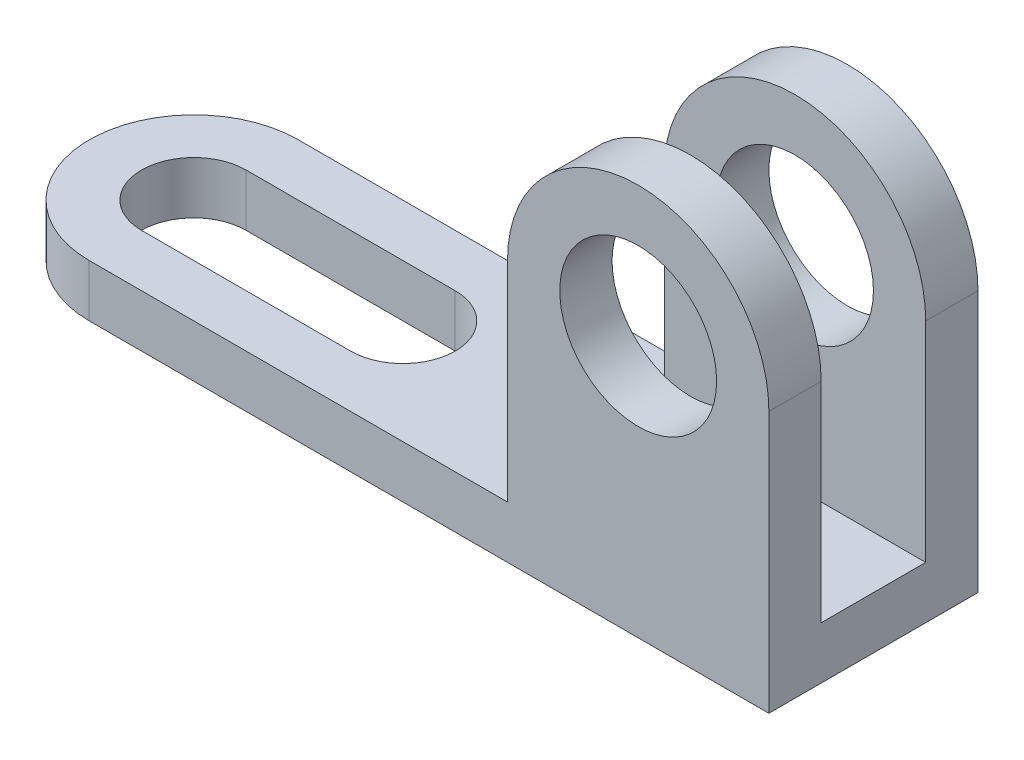
from build123d import *

# Parameters (mm, degrees)
BOSS_EXTRUDE1_DEPTH      = 10
BOSS_EXTRUDE2_DEPTH      = 40
BOSS_EXTRUDE2_DEPTH_BACK = 10
SKETCH2_W                = 50
SKETCH2_H                = 10
SKETCH3_R                = 25
BOSS_EXTRUDE3_DEPTH      = 10
BOSS_EXTRUDE4_START      = -10
SKETCH4_R                = 25
BOSS_EXTRUDE4_DEPTH      = 10
CUT_EXTRUDE1_START       = -40
SKETCH5_R                = 15
CUT_EXTRUDE1_DEPTH       = 40


with BuildPart() as part:
    # Sketch1 → Boss-Extrude1 (new body)
    with BuildSketch(Plane(origin=(0, 0, 0), x_dir=(1, 0, 0), z_dir=(0, 1, 0))):
        with BuildLine():
            Line((15, 20), (-65, 20))
            ThreePointArc((-65, 20), (-85, 0), (-65, -20))
            Line((-65, -20), (15, -20))
            Line((15, -20), (15, -10))
            Line((15, -10), (65, -10))
            Line((65, -10), (65, 10))
            Line((65, 10), (15, 10))
            Line((15, 10), (15, 20))
        make_face()
        with BuildLine():
            ThreePointArc((-25, 10), (-15, 0), (-25, -10))
            Line((-25, -10), (-65, -10))
            ThreePointArc((-65, -10), (-75, 0), (-65, 10))
            Line((-65, 10), (-25, 10))
        make_face(mode=Mode.SUBTRACT)
    extrude(amount=BOSS_EXTRUDE1_DEPTH)

    # Sketch2 → Boss-Extrude2 (add, two sides: drawn at the far end of the back side and taken through both)
    with BuildSketch(Plane(origin=(0, 10, 0), x_dir=(1, 0, 0), z_dir=(0, 1, 0)).offset(-BOSS_EXTRUDE2_DEPTH_BACK)):
        with Locations((40, -15)):
            Rectangle(SKETCH2_W, SKETCH2_H)
        with Locations((40, 15)):
            Rectangle(SKETCH2_W, SKETCH2_H)
    extrude(amount=BOSS_EXTRUDE2_DEPTH + BOSS_EXTRUDE2_DEPTH_BACK)

    # Sketch3 → Boss-Extrude3 (add)
    with BuildSketch(Plane.XY.offset(20)):
        with Locations((40, 50)):
            Circle(SKETCH3_R)
    extrude(amount=-BOSS_EXTRUDE3_DEPTH)

    # Sketch4 → Boss-Extrude4 (add)
    with BuildSketch(Plane(origin=(0, 0, -20), x_dir=(-1, 0, 0), z_dir=(0, 0, -1)).offset(BOSS_EXTRUDE4_START)):
        with Locations((-40, 50)):
            Circle(SKETCH4_R)
    extrude(amount=BOSS_EXTRUDE4_DEPTH)

    # Sketch5 → Cut-Extrude1 (cut)
    with BuildSketch(Plane.XY.offset(20).offset(CUT_EXTRUDE1_START)):
        with Locations((40, 50)):
            Circle(SKETCH5_R)
    extrude(amount=CUT_EXTRUDE1_DEPTH, mode=Mode.SUBTRACT)


solid = part.part
